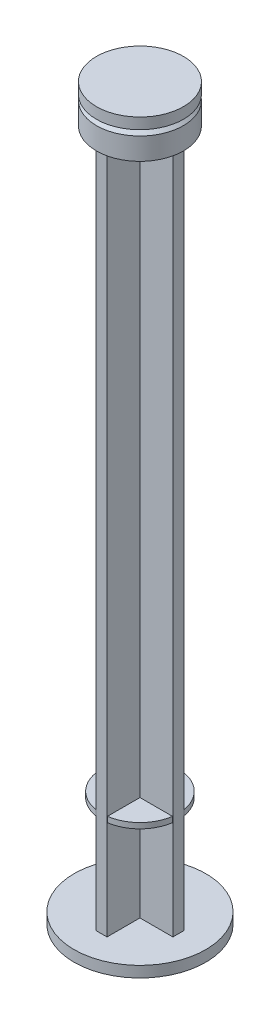
from build123d import *

# Parameters (mm, degrees)
SKETCH1_R      = 6
EXTRUDE1_DEPTH = 1
EXTRUDE2_DEPTH = 62
SKETCH5_R      = 3.5
EXTRUDE4_DEPTH = 0.5
SKETCH6_R      = 0.53375681
EXTRUDE5_DEPTH = 1.5
SKETCH7_R      = 3.962531225
EXTRUDE6_DEPTH = 2.5
CHAMFER1_SIZE  = 0.5
SKETCH8_R      = 3.96497508
EXTRUDE7_DEPTH = 1


with BuildPart() as part:
    # Sketch1 → Extrude1 (new body)
    with BuildSketch(Plane(origin=(0, 0, 0), x_dir=(1, 0, 0), z_dir=(0, 1, 0))):
        with Locations(Location((0, 0, 0), (0, 0, 270))):
            Circle(SKETCH1_R)
    extrude(amount=EXTRUDE1_DEPTH)

    # Sketch2 → Extrude2 (add)
    with BuildSketch(Plane(origin=(0, 1, 0), x_dir=(-1, 0, 0), z_dir=(0, 1, 0))):
        Polygon((0.5, 0.5), (0.5, 3.5), (-0.5, 3.5), (-0.5, 0.5), (-3.5, 0.5), (-3.5, -0.5), (-0.5, -0.5), (-0.5, -3.5), (0.5, -3.5), (0.5, -0.5), (3.5, -0.5), (3.5, 0.5), align=None)
    extrude(amount=EXTRUDE2_DEPTH)

    # Sketch5 → Extrude4 (add)
    with BuildSketch(Plane(origin=(0, 10, 0), x_dir=(-1, 0, 0), z_dir=(0, 1, 0))):
        Circle(SKETCH5_R)
    extrude(amount=EXTRUDE4_DEPTH)

    # Sketch6 → Extrude5 (add)
    with BuildSketch(Plane(origin=(0, 63, 0), x_dir=(-1, 0, 0), z_dir=(0, 1, 0))):
        with Locations(Location((0, 0, 0), (0, 0, 270))):
            Circle(SKETCH6_R)
    extrude(amount=EXTRUDE5_DEPTH)

    # Sketch7 → Extrude6 (add)
    with BuildSketch(Plane(origin=(0, 63, 0), x_dir=(-1, 0, 0), z_dir=(0, 1, 0))):
        with Locations(Location((0, 0, 0), (0, 0, 90))):
            Circle(SKETCH7_R)
    extrude(amount=EXTRUDE6_DEPTH)

    # Chamfer1
    chamfer1_edges = [part.edges().sort_by_distance(p)[0] for p in [
        (0, 65.5, -3.962531225),
    ]]
    chamfer(chamfer1_edges, length=CHAMFER1_SIZE)

    # Sketch8 → Extrude7 (add)
    with BuildSketch(Plane(origin=(0, 65.5, 0), x_dir=(-1, 0, 0), z_dir=(0, 1, 0))):
        with Locations(Location((0, 0, 0), (0, 0, 90))):
            Circle(SKETCH8_R)
    extrude(amount=EXTRUDE7_DEPTH)


solid = part.part
